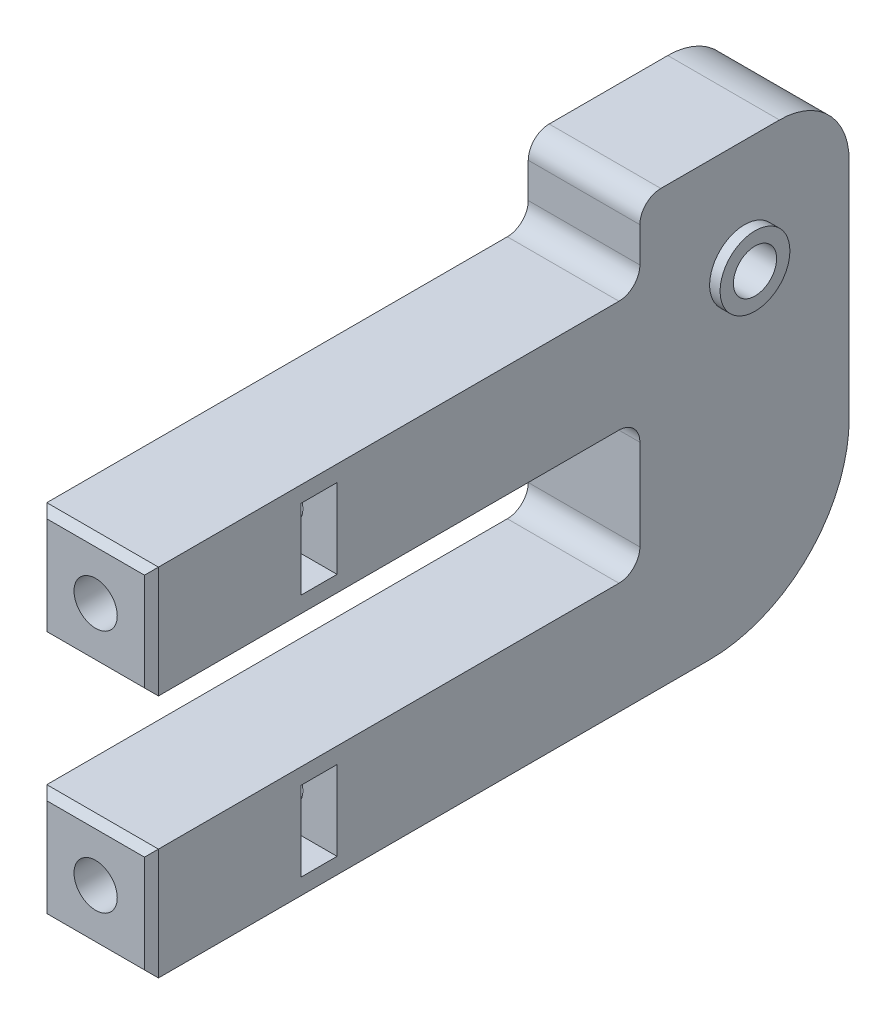
from build123d import *

# Parameters (mm, degrees)
SKETCH1_R           = 1.55
BOSS_EXTRUDE1_DEPTH = 8
SKETCH4_R           = 1.55
CUT_EXTRUDE2_DEPTH  = 20
SKETCH5_W           = 2.6
SKETCH5_H           = 5.7
CUT_EXTRUDE3_DEPTH  = 60.371710435
FILLET2_R           = 1.5
FILLET3_R           = 5
FILLET4_R           = 10
CHAMFER1_SIZE       = 0.5
SKETCH6_R           = 2.5
SKETCH6_R_2         = 1.55
BOSS_EXTRUDE3_DEPTH = 0.75
CUT_EXTRUDE4_DEPTH  = 4


with BuildPart() as part:
    # Sketch1 → Boss-Extrude1 (new body)
    with BuildSketch(Plane(origin=(0, 0, 0), x_dir=(0, 0, -1), z_dir=(1, 0, 0))):
        Polygon((0, 0), (50, 0), (50, 31), (35, 31), (35, 25.5), (0, 25.5), (0, 17.5), (35, 17.5), (35, 8), (0, 8), align=None)
        with Locations((42.5, 23.25)):
            Circle(SKETCH1_R, mode=Mode.SUBTRACT)
    extrude(amount=BOSS_EXTRUDE1_DEPTH)

    # Sketch4 → Cut-Extrude2 (cut)
    with BuildSketch(Plane.XY):
        with Locations((4, 21.5)):
            Circle(SKETCH4_R)
        with Locations((4, 4)):
            Circle(SKETCH4_R)
    extrude(amount=-CUT_EXTRUDE2_DEPTH, mode=Mode.SUBTRACT)

    # Sketch5 → Cut-Extrude3 (cut, through all)
    with BuildSketch(Plane.ZY):
        with Locations((-12, 21.5)):
            Rectangle(SKETCH5_W, SKETCH5_H)
        with Locations((-12, 4)):
            Rectangle(SKETCH5_W, SKETCH5_H)
    extrude(amount=-CUT_EXTRUDE3_DEPTH, mode=Mode.SUBTRACT)

    # Fillet2
    fillet2_edges = [part.edges().sort_by_distance(p)[0] for p in [
        (4, 8, -35),
        (4, 17.5, -35),
        (4, 25.5, -35),
        (4, 31, -35),
    ]]
    fillet(fillet2_edges, radius=FILLET2_R)

    # Fillet3
    fillet3_edges = [part.edges().sort_by_distance(p)[0] for p in [
        (4, 31, -50),
    ]]
    fillet(fillet3_edges, radius=FILLET3_R)

    # Fillet4
    fillet4_edges = [part.edges().sort_by_distance(p)[0] for p in [
        (4, 0, -50),
    ]]
    fillet(fillet4_edges, radius=FILLET4_R)

    # Chamfer1
    chamfer1_edges = [part.edges().sort_by_distance(p)[0] for p in [
        (0, 21.5, 0),
        (0, 4, 0),
        (4, 8, 0),
        (4, 17.5, 0),
        (4, 25.5, 0),
        (4, 0, 0),
        (8, 21.5, 0),
        (8, 4, 0),
    ]]
    chamfer(chamfer1_edges, length=CHAMFER1_SIZE)

    # Sketch6 → Boss-Extrude3 (add)
    with BuildSketch(Plane(origin=(8, 0, 0), x_dir=(0, 0, -1), z_dir=(1, 0, 0))):
        with Locations((42.5, 23.25)):
            Circle(SKETCH6_R)
        with Locations((42.5, 23.25)):
            Circle(SKETCH6_R_2, mode=Mode.SUBTRACT)
    extrude(amount=BOSS_EXTRUDE3_DEPTH)

    # Sketch7 → Cut-Extrude4 (cut)
    with BuildSketch(Plane.ZY):
        Polygon((-39.750369343, 24.8375), (-42.5, 26.425), (-45.249630657, 24.8375), (-45.249630657, 21.6625), (-42.5, 20.075), (-39.750369343, 21.6625), align=None)
    extrude(amount=-CUT_EXTRUDE4_DEPTH, mode=Mode.SUBTRACT)


solid = part.part
